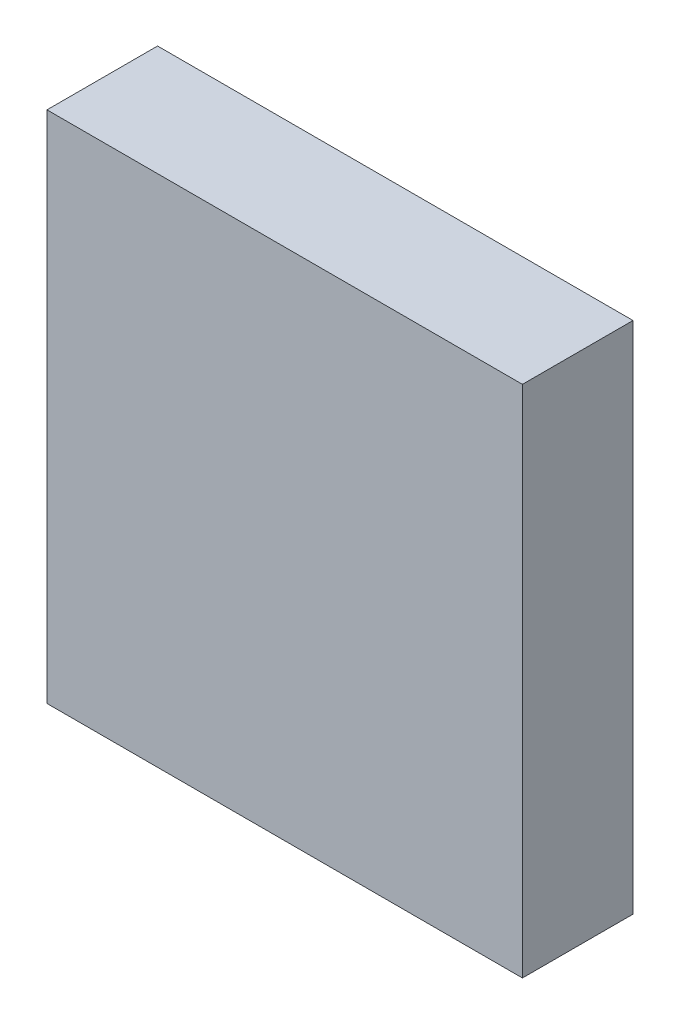
from build123d import *

# Parameters (mm, degrees)
SKETCH1_W           = 430
SKETCH1_H           = 465
BOSS_EXTRUDE1_DEPTH = 50


with BuildPart() as part:
    # Sketch1 → Boss-Extrude1 (new, symmetric)
    with BuildSketch(Plane.XY):
        Rectangle(SKETCH1_W, SKETCH1_H)
    extrude(amount=BOSS_EXTRUDE1_DEPTH, both=True)


solid = part.part
